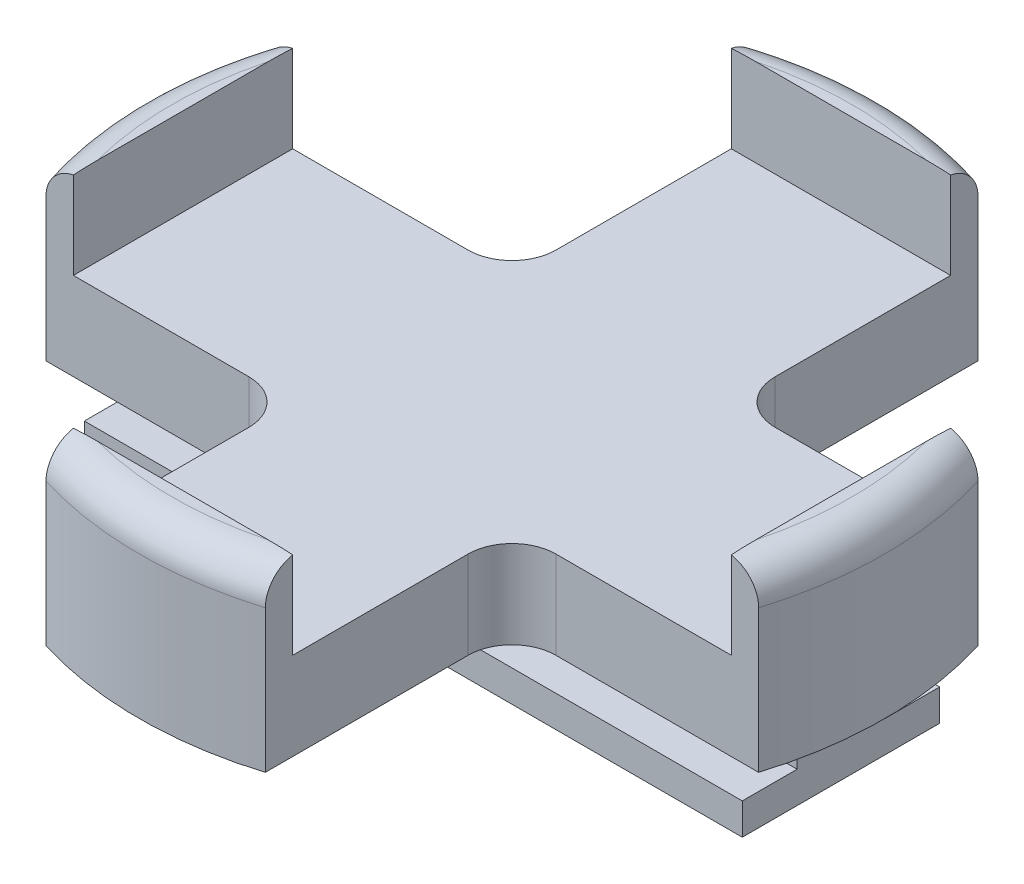
from build123d import *

# Parameters (mm, degrees)
BOSS_EXTRUDE1_DEPTH      = 4
BOSS_EXTRUDE6_DEPTH      = 8
BOSS_EXTRUDE5_DEPTH      = 15
BOSS_EXTRUDE5_DEPTH_BACK = 15
FILLET2_R                = 1.5
CIRPATTERN2_COUNT        = 4
FILLET2_OF_CIRPATTERN2_R = 1.5
FILLET4_R                = 2


with BuildPart() as part:
    # Sketch1 → Boss-Extrude1 (new body)
    with BuildSketch(Plane(origin=(0, 0, 0), x_dir=(1, 0, 0), z_dir=(0, 1, 0))):
        with BuildLine():
            ThreePointArc((5, 16.248076809), (0, 17), (-5, 16.248076809))
            Line((-5, 16.248076809), (-5, 0))
            Line((-5, 0), (5, 0))
            Line((5, 0), (5, 16.248076809))
        make_face()
    boss_extrude1 = extrude(amount=BOSS_EXTRUDE1_DEPTH)

    # Sketch1<6> → Boss-Extrude6 (add)
    with BuildSketch(Plane(origin=(0, 0, 0), x_dir=(1, 0, 0), z_dir=(0, 1, 0))):
        with BuildLine():
            Line((5, 15), (5, 16.248076809))
            ThreePointArc((5, 16.248076809), (0, 17), (-5, 16.248076809))
            Line((-5, 16.248076809), (-5, 15))
            Line((-5, 15), (5, 15))
        make_face()
    boss_extrude6 = extrude(amount=BOSS_EXTRUDE6_DEPTH)

    # Sketch4 → Boss-Extrude5 (add, two sides: drawn at the far end of the back side and taken through both)
    with BuildSketch(Plane.ZY.offset(-BOSS_EXTRUDE5_DEPTH_BACK)):
        Polygon((-2, 0), (-2, -2), (-4.5, -2), (-4.5, -3.436102186), (4.5, -3.436102186), (4.5, -2), (2, -2), (2, 0), align=None)
    extrude(amount=BOSS_EXTRUDE5_DEPTH + BOSS_EXTRUDE5_DEPTH_BACK)

    # Fillet2
    fillet2_edges = [part.edges().sort_by_distance(p)[0] for p in [
        (0, 8, -17),
    ]]
    fillet(fillet2_edges, radius=FILLET2_R)

    # CirPattern2: Boss-Extrude1, Boss-Extrude6 ×4 about axis
    cirpattern2_axis = Axis((0, 0, 0), (0, 1, 0))
    add([boss_extrude1.rotate(cirpattern2_axis, i * 360 / CIRPATTERN2_COUNT) for i in range(1, CIRPATTERN2_COUNT)])
    add([boss_extrude6.rotate(cirpattern2_axis, i * 360 / CIRPATTERN2_COUNT) for i in range(1, CIRPATTERN2_COUNT)])

    # Fillet2 of CirPattern2
    fillet2_of_cirpattern2_edges = [part.edges().sort_by_distance(p)[0] for p in [
        (-17, 8, 0),
        (0, 8, 17),
        (17, 8, 0),
    ]]
    fillet(fillet2_of_cirpattern2_edges, radius=FILLET2_OF_CIRPATTERN2_R)

    # Fillet4
    fillet4_edges = [part.edges().sort_by_distance(p)[0] for p in [
        (-5, 2, 5),
        (5, 2, 5),
        (5, 2, -5),
        (-5, 2, -5),
    ]]
    fillet(fillet4_edges, radius=FILLET4_R)


solid = part.part
